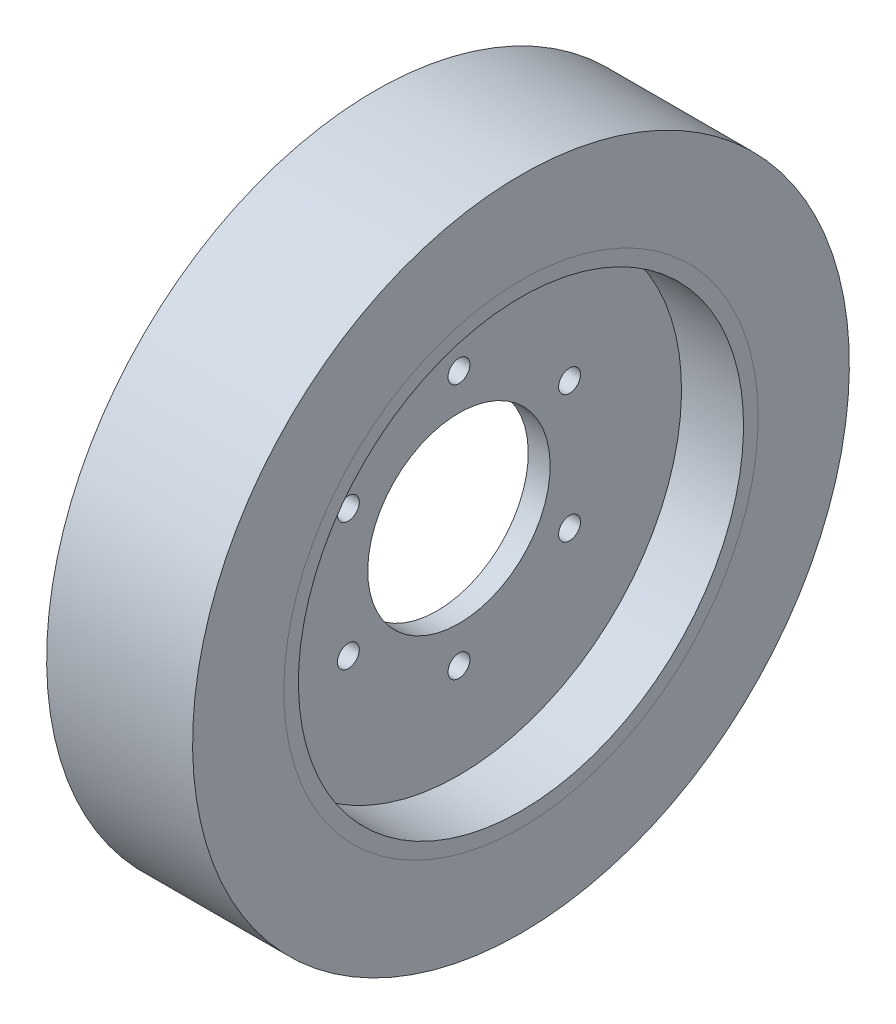
from build123d import *

# Parameters (mm, degrees)
SKETCH2_R           = 25
SKETCH2_R_2         = 3
CUT_EXTRUDE1_DEPTH  = 95.757585448
SKETCH4_R           = 90
SKETCH4_R_2         = 65
BOSS_EXTRUDE1_DEPTH = 40


with BuildPart() as part:
    # Sketch1 → Revolve1 (revolve)
    with BuildSketch(Plane.XY, mode=Mode.PRIVATE) as revolve1_sk:
        Polygon((0, 65), (-20, 65), (-20, 59), (-3, 59), (-3, 0), (3, 0), (3, 61), (20, 61), (20, 65), align=None)
    revolve(revolve1_sk.sketch.rotate(Axis((-3, 0, 0), (1, 0, 0)), 180), axis=Axis((-3, 0, 0), (1, 0, 0)))

    # Sketch2 → Cut-Extrude1 (cut, through all)
    with BuildSketch(Plane.ZY.offset(3)):
        with Locations(Location((0, 0, 0), (0, 0, 270))):
            Circle(SKETCH2_R)
        with Locations(Location((0, 35, 0), (0, 0, 270))):
            Circle(SKETCH2_R_2)
        with Locations(Location((30.310889132, 17.5, 0), (0, 0, 270))):
            Circle(SKETCH2_R_2)
        with Locations(Location((30.310889132, -17.5, 0), (0, 0, 270))):
            Circle(SKETCH2_R_2)
        with Locations(Location((0, -35, 0), (0, 0, 270))):
            Circle(SKETCH2_R_2)
        with Locations(Location((-30.310889132, -17.5, 0), (0, 0, 270))):
            Circle(SKETCH2_R_2)
        with Locations(Location((-30.310889132, 17.5, 0), (0, 0, 270))):
            Circle(SKETCH2_R_2)
    extrude(amount=-CUT_EXTRUDE1_DEPTH, mode=Mode.SUBTRACT)


with BuildPart() as body_2:
    # Sketch4 → Boss-Extrude1 (new body)
    with BuildSketch(Plane.ZY.offset(20)):
        with Locations(Location((0, 0, 0), (0, 0, 270))):
            Circle(SKETCH4_R)
        with Locations(Location((0, 0, 0), (0, 0, 270))):
            Circle(SKETCH4_R_2, mode=Mode.SUBTRACT)
    extrude(amount=-BOSS_EXTRUDE1_DEPTH)


solid = Compound([part.part, body_2.part])
